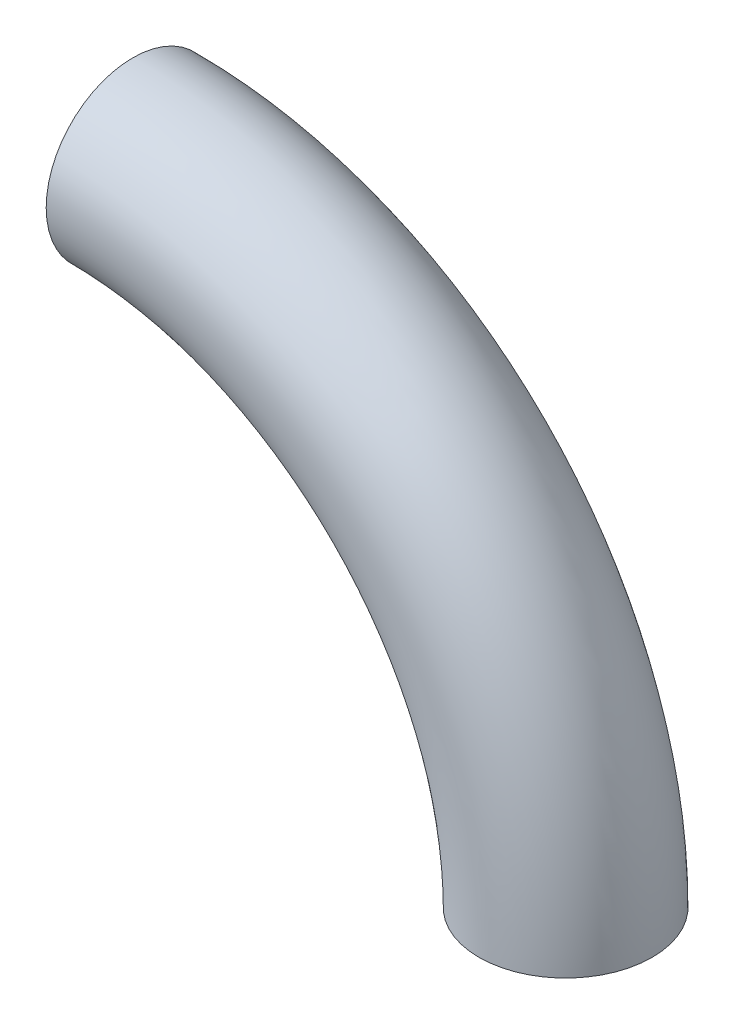
from build123d import *

# Parameters (mm, degrees)
SKETCH_PROFILE_R    = 4
FEATURE_TORUS_ANGLE = 90


with BuildPart() as part:
    # sketch:profile → feature:torus (revolve)
    with BuildSketch(Plane.XZ):
        with Locations((20, 0)):
            Circle(SKETCH_PROFILE_R)
    revolve(axis=Axis((0, 0, -15), (0, 0, 1)), revolution_arc=FEATURE_TORUS_ANGLE)


solid = part.part
